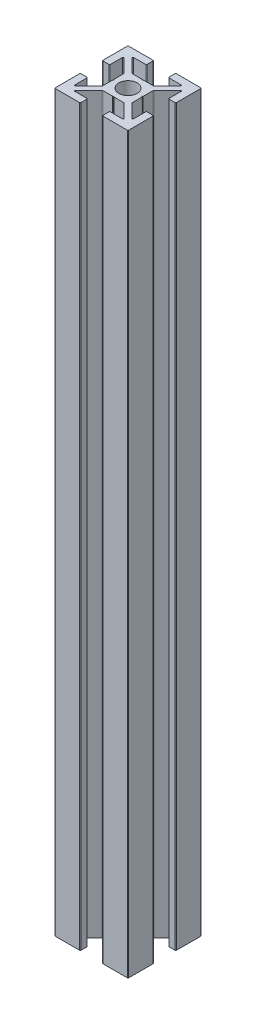
from build123d import *

# Parameters (mm, degrees)
SKETCH1_R           = 2.5
BOSS_EXTRUDE1_DEPTH = 200


with BuildPart() as part:
    # Sketch1 → Boss-Extrude1 (new body)
    with BuildSketch(Plane(origin=(0, 0, 0), x_dir=(1, 0, 0), z_dir=(0, 1, 0))):
        with BuildLine():
            Line((-2.997918472, 4.058578644), (-6.597918472, 7.658578644))
            ThreePointArc((-6.597918472, 7.658578644), (-6.621415508, 7.686854412), (-6.639339828, 7.718953455))
            ThreePointArc((-6.639339828, 7.718953455), (-6.656497116, 7.8), (-6.639339828, 7.881046545))
            ThreePointArc((-6.639339828, 7.881046545), (-6.565562901, 7.967644429), (-6.456497116, 8))
            Line((-6.456497116, 8), (-3.2, 8))
            ThreePointArc((-3.2, 8), (-3.058578644, 8.058578644), (-3, 8.2))
            Line((-3, 8.2), (-3, 9.8))
            ThreePointArc((-3, 9.8), (-3.058578644, 9.941421356), (-3.2, 10))
            Line((-3.2, 10), (-9.8, 10))
            ThreePointArc((-9.8, 10), (-9.941421356, 9.941421356), (-10, 9.8))
            Line((-10, 9.8), (-10, 3.2))
            ThreePointArc((-10, 3.2), (-9.941421356, 3.058578644), (-9.8, 3))
            Line((-9.8, 3), (-8.2, 3))
            ThreePointArc((-8.2, 3), (-8.058578644, 3.058578644), (-8, 3.2))
            Line((-8, 3.2), (-8, 6.456497116))
            ThreePointArc((-8, 6.456497116), (-7.967644429, 6.565562901), (-7.881046545, 6.639339828))
            ThreePointArc((-7.881046545, 6.639339828), (-7.8, 6.656497116), (-7.718953455, 6.639339828))
            ThreePointArc((-7.718953455, 6.639339828), (-7.686854412, 6.621415508), (-7.658578644, 6.597918472))
            Line((-7.658578644, 6.597918472), (-4.058578644, 2.997918472))
            ThreePointArc((-4.058578644, 2.997918472), (-4.015224093, 2.933033802), (-4, 2.856497116))
            Line((-4, 2.856497116), (-4, 0.130901699))
            ThreePointArc((-4, 0.130901699), (-3.99253254, 0.104615144), (-3.97236068, 0.08618034))
            Line((-3.97236068, 0.08618034), (-3.8, 0))
            Line((-3.8, 0), (-3.97236068, -0.08618034))
            ThreePointArc((-3.97236068, -0.08618034), (-3.99253254, -0.104615144), (-4, -0.130901699))
            Line((-4, -0.130901699), (-4, -2.856497116))
            ThreePointArc((-4, -2.856497116), (-4.015224093, -2.933033802), (-4.058578644, -2.997918472))
            Line((-4.058578644, -2.997918472), (-7.658578644, -6.597918472))
            ThreePointArc((-7.658578644, -6.597918472), (-7.686854412, -6.621415508), (-7.718953455, -6.639339828))
            ThreePointArc((-7.718953455, -6.639339828), (-7.8, -6.656497116), (-7.881046545, -6.639339828))
            ThreePointArc((-7.881046545, -6.639339828), (-7.967644429, -6.565562901), (-8, -6.456497116))
            Line((-8, -6.456497116), (-8, -3.2))
            ThreePointArc((-8, -3.2), (-8.058578644, -3.058578644), (-8.2, -3))
            Line((-8.2, -3), (-9.8, -3))
            ThreePointArc((-9.8, -3), (-9.941421356, -3.058578644), (-10, -3.2))
            Line((-10, -3.2), (-10, -9.8))
            ThreePointArc((-10, -9.8), (-9.941421356, -9.941421356), (-9.8, -10))
            Line((-9.8, -10), (-3.2, -10))
            ThreePointArc((-3.2, -10), (-3.058578644, -9.941421356), (-3, -9.8))
            Line((-3, -9.8), (-3, -8.2))
            ThreePointArc((-3, -8.2), (-3.058578644, -8.058578644), (-3.2, -8))
            Line((-3.2, -8), (-6.456497116, -8))
            ThreePointArc((-6.456497116, -8), (-6.565562901, -7.967644429), (-6.639339828, -7.881046545))
            ThreePointArc((-6.639339828, -7.881046545), (-6.656497116, -7.8), (-6.639339828, -7.718953455))
            ThreePointArc((-6.639339828, -7.718953455), (-6.621415508, -7.686854412), (-6.597918472, -7.658578644))
            Line((-6.597918472, -7.658578644), (-2.997918472, -4.058578644))
            ThreePointArc((-2.997918472, -4.058578644), (-2.933033802, -4.015224093), (-2.856497116, -4))
            Line((-2.856497116, -4), (-0.211803399, -4))
            ThreePointArc((-0.211803399, -4), (-0.200315753, -3.998662449), (-0.189442719, -3.99472136))
            Line((-0.189442719, -3.99472136), (0, -3.9))
            Line((0, -3.9), (0.189442719, -3.99472136))
            ThreePointArc((0.189442719, -3.99472136), (0.200315753, -3.998662449), (0.211803399, -4))
            Line((0.211803399, -4), (2.856497116, -4))
            ThreePointArc((2.856497116, -4), (2.933033802, -4.015224093), (2.997918472, -4.058578644))
            Line((2.997918472, -4.058578644), (6.597918472, -7.658578644))
            ThreePointArc((6.597918472, -7.658578644), (6.621415508, -7.686854412), (6.639339828, -7.718953455))
            ThreePointArc((6.639339828, -7.718953455), (6.656497116, -7.8), (6.639339828, -7.881046545))
            ThreePointArc((6.639339828, -7.881046545), (6.565562901, -7.967644429), (6.456497116, -8))
            Line((6.456497116, -8), (3.2, -8))
            ThreePointArc((3.2, -8), (3.058578644, -8.058578644), (3, -8.2))
            Line((3, -8.2), (3, -9.8))
            ThreePointArc((3, -9.8), (3.058578644, -9.941421356), (3.2, -10))
            Line((3.2, -10), (9.8, -10))
            ThreePointArc((9.8, -10), (9.941421356, -9.941421356), (10, -9.8))
            Line((10, -9.8), (10, -3.2))
            ThreePointArc((10, -3.2), (9.941421356, -3.058578644), (9.8, -3))
            Line((9.8, -3), (8.2, -3))
            ThreePointArc((8.2, -3), (8.058578644, -3.058578644), (8, -3.2))
            Line((8, -3.2), (8, -6.456497116))
            ThreePointArc((8, -6.456497116), (7.967644429, -6.565562901), (7.881046545, -6.639339828))
            ThreePointArc((7.881046545, -6.639339828), (7.8, -6.656497116), (7.718953455, -6.639339828))
            ThreePointArc((7.718953455, -6.639339828), (7.686854412, -6.621415508), (7.658578644, -6.597918472))
            Line((7.658578644, -6.597918472), (4.058578644, -2.997918472))
            ThreePointArc((4.058578644, -2.997918472), (4.015224093, -2.933033802), (4, -2.856497116))
            Line((4, -2.856497116), (4, -0.130901699))
            ThreePointArc((4, -0.130901699), (3.99253254, -0.104615144), (3.97236068, -0.08618034))
            Line((3.97236068, -0.08618034), (3.8, 0))
            Line((3.8, 0), (3.97236068, 0.08618034))
            ThreePointArc((3.97236068, 0.08618034), (3.99253254, 0.104615144), (4, 0.130901699))
            Line((4, 0.130901699), (4, 2.856497116))
            ThreePointArc((4, 2.856497116), (4.015224093, 2.933033802), (4.058578644, 2.997918472))
            Line((4.058578644, 2.997918472), (7.658578644, 6.597918472))
            ThreePointArc((7.658578644, 6.597918472), (7.686854412, 6.621415508), (7.718953455, 6.639339828))
            ThreePointArc((7.718953455, 6.639339828), (7.8, 6.656497116), (7.881046545, 6.639339828))
            ThreePointArc((7.881046545, 6.639339828), (7.967644429, 6.565562901), (8, 6.456497116))
            Line((8, 6.456497116), (8, 3.2))
            ThreePointArc((8, 3.2), (8.058578644, 3.058578644), (8.2, 3))
            Line((8.2, 3), (9.8, 3))
            ThreePointArc((9.8, 3), (9.941421356, 3.058578644), (10, 3.2))
            Line((10, 3.2), (10, 9.8))
            ThreePointArc((10, 9.8), (9.941421356, 9.941421356), (9.8, 10))
            Line((9.8, 10), (3.2, 10))
            ThreePointArc((3.2, 10), (3.058578644, 9.941421356), (3, 9.8))
            Line((3, 9.8), (3, 8.2))
            ThreePointArc((3, 8.2), (3.058578644, 8.058578644), (3.2, 8))
            Line((3.2, 8), (6.456497116, 8))
            ThreePointArc((6.456497116, 8), (6.565562901, 7.967644429), (6.639339828, 7.881046545))
            ThreePointArc((6.639339828, 7.881046545), (6.656497116, 7.8), (6.639339828, 7.718953455))
            ThreePointArc((6.639339828, 7.718953455), (6.621415508, 7.686854412), (6.597918472, 7.658578644))
            Line((6.597918472, 7.658578644), (2.997918472, 4.058578644))
            ThreePointArc((2.997918472, 4.058578644), (2.933033802, 4.015224093), (2.856497116, 4))
            Line((2.856497116, 4), (0.211803399, 4))
            ThreePointArc((0.211803399, 4), (0.200315753, 3.998662449), (0.189442719, 3.99472136))
            Line((0.189442719, 3.99472136), (0, 3.9))
            Line((0, 3.9), (-0.189442719, 3.99472136))
            ThreePointArc((-0.189442719, 3.99472136), (-0.200315753, 3.998662449), (-0.211803399, 4))
            Line((-0.211803399, 4), (-2.856497116, 4))
            ThreePointArc((-2.856497116, 4), (-2.933033802, 4.015224093), (-2.997918472, 4.058578644))
        make_face()
        Circle(SKETCH1_R, mode=Mode.SUBTRACT)
    extrude(amount=BOSS_EXTRUDE1_DEPTH)


solid = part.part
